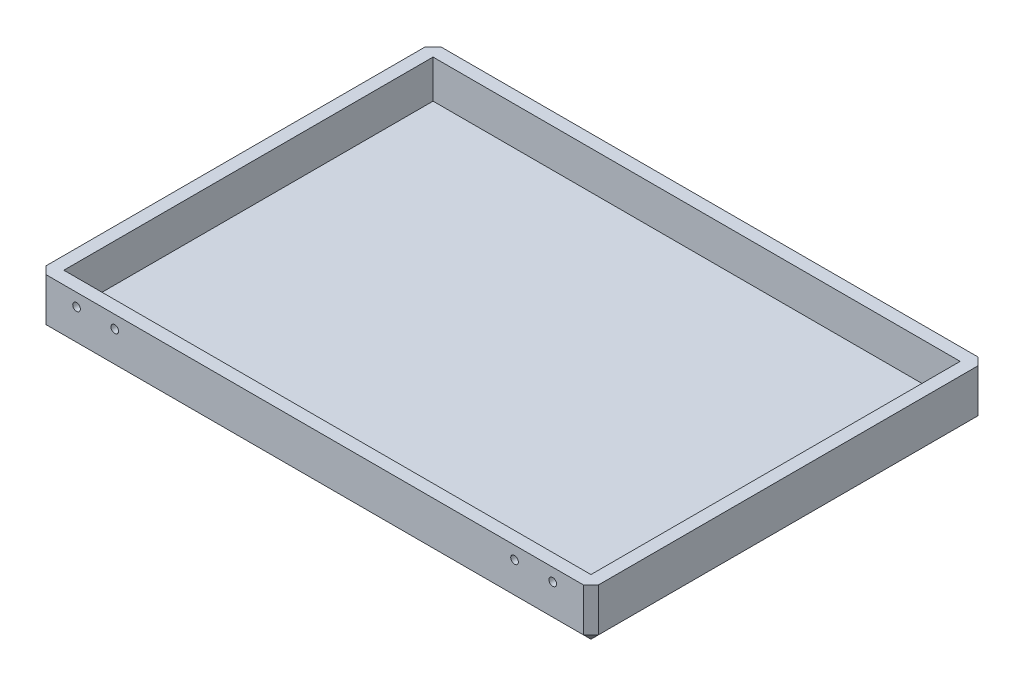
from build123d import *

# Parameters (mm, degrees)
SKIZZE2_W                       = 217
SKIZZE2_H                       = 155
AUFSATZ_LINEAR_AUSTRAGEN1_DEPTH = 20
WANDUNG1_T                      = -5
SCHNITT_LINEAR_AUSTRAGEN1_REACH = 192.256
SKIZZE7_R                       = 1.5
FASE1_SIZE                      = 3
SCHNITT_LINEAR_AUSTRAGEN2_DEPTH = 1


with BuildPart() as part:
    # Skizze2 → Aufsatz-Linear austragen1 (new body)
    with BuildSketch(Plane(origin=(0, 0, 0), x_dir=(1, 0, 0), z_dir=(0, 1, 0))):
        Rectangle(SKIZZE2_W, SKIZZE2_H)
    extrude(amount=AUFSATZ_LINEAR_AUSTRAGEN1_DEPTH)

    # Wandung1
    wandung1_openings = [part.faces().sort_by_distance(p)[0] for p in [
        (0, 20, 0),
    ]]
    offset(amount=WANDUNG1_T, openings=wandung1_openings, kind=Kind.INTERSECTION)

    # Skizze7 → Schnitt-Linear austragen1 (cut, up to next)
    with BuildSketch(Plane.XY.offset(77.5), mode=Mode.PRIVATE) as schnitt_linear_austragen1_sk1:
        with Locations((-93.5, 15)):
            Circle(SKIZZE7_R)
    schnitt_linear_austragen1_tool1 = extrude(schnitt_linear_austragen1_sk1.sketch, amount=-SCHNITT_LINEAR_AUSTRAGEN1_REACH, mode=Mode.PRIVATE) & part.part
    # Skizze7 → Schnitt-Linear austragen1 (cut, up to next)
    with BuildSketch(Plane.XY.offset(77.5), mode=Mode.PRIVATE) as schnitt_linear_austragen1_sk2:
        with Locations((-78.5, 15)):
            Circle(SKIZZE7_R)
    schnitt_linear_austragen1_tool2 = extrude(schnitt_linear_austragen1_sk2.sketch, amount=-SCHNITT_LINEAR_AUSTRAGEN1_REACH, mode=Mode.PRIVATE) & part.part
    # Skizze7 → Schnitt-Linear austragen1 (cut, up to next)
    with BuildSketch(Plane.XY.offset(77.5), mode=Mode.PRIVATE) as schnitt_linear_austragen1_sk3:
        with Locations((78.5, 15)):
            Circle(SKIZZE7_R)
    schnitt_linear_austragen1_tool3 = extrude(schnitt_linear_austragen1_sk3.sketch, amount=-SCHNITT_LINEAR_AUSTRAGEN1_REACH, mode=Mode.PRIVATE) & part.part
    # Skizze7 → Schnitt-Linear austragen1 (cut, up to next)
    with BuildSketch(Plane.XY.offset(77.5), mode=Mode.PRIVATE) as schnitt_linear_austragen1_sk4:
        with Locations((93.5, 15)):
            Circle(SKIZZE7_R)
    schnitt_linear_austragen1_tool4 = extrude(schnitt_linear_austragen1_sk4.sketch, amount=-SCHNITT_LINEAR_AUSTRAGEN1_REACH, mode=Mode.PRIVATE) & part.part
    add(schnitt_linear_austragen1_tool1.solids().sort_by_distance((-93.5, 15, 77.5))[0], mode=Mode.SUBTRACT)
    add(schnitt_linear_austragen1_tool2.solids().sort_by_distance((-78.5, 15, 77.5))[0], mode=Mode.SUBTRACT)
    add(schnitt_linear_austragen1_tool3.solids().sort_by_distance((78.5, 15, 77.5))[0], mode=Mode.SUBTRACT)
    add(schnitt_linear_austragen1_tool4.solids().sort_by_distance((93.5, 15, 77.5))[0], mode=Mode.SUBTRACT)

    # Fase1
    fase1_edges = [part.edges().sort_by_distance(p)[0] for p in [
        (0, 0, 77.5),
        (-108.5, 0, 0),
        (0, 0, -77.5),
        (108.5, 0, 0),
        (108.5, 10, 77.5),
        (-108.5, 10, 77.5),
        (-108.5, 10, -77.5),
        (108.5, 10, -77.5),
    ]]
    chamfer(fase1_edges, length=FASE1_SIZE)

    # Skizze8 → Schnitt-Linear austragen2 (cut)
    with BuildSketch(Plane.XZ):
        with BuildLine():
            Line((-96.881197846, -69.2), (-96.881197846, -62.8))
            ThreePointArc((-96.881197846, -62.8), (-96.969065812, -62.587867966), (-97.181197846, -62.5))
            Line((-97.181197846, -62.5), (-99.980384758, -62.5))
            ThreePointArc((-99.980384758, -62.5), (-100.240192379, -62.35), (-100.240192379, -62.05))
            Line((-100.240192379, -62.05), (-96.441005468, -55.469615242))
            ThreePointArc((-96.441005468, -55.469615242), (-96.103552133, -55.329837494), (-95.881197846, -55.619615242))
            Line((-95.881197846, -55.619615242), (-95.881197846, -61.2))
            ThreePointArc((-95.881197846, -61.2), (-95.793329881, -61.412132034), (-95.581197846, -61.5))
            Line((-95.581197846, -61.5), (-91.181197846, -61.5))
            ThreePointArc((-91.181197846, -61.5), (-90.969065812, -61.412132034), (-90.881197846, -61.2))
            Line((-90.881197846, -61.2), (-90.881197846, -54.8))
            ThreePointArc((-90.881197846, -54.8), (-90.793329881, -54.587867966), (-90.581197846, -54.5))
            Line((-90.581197846, -54.5), (-90.181197846, -54.5))
            ThreePointArc((-90.181197846, -54.5), (-89.969065812, -54.587867966), (-89.881197846, -54.8))
            Line((-89.881197846, -54.8), (-89.881197846, -61.2))
            ThreePointArc((-89.881197846, -61.2), (-89.793329881, -61.412132034), (-89.581197846, -61.5))
            Line((-89.581197846, -61.5), (-86.782010935, -61.5))
            ThreePointArc((-86.782010935, -61.5), (-86.522203314, -61.65), (-86.522203314, -61.95))
            Line((-86.522203314, -61.95), (-90.321390225, -68.530384758))
            ThreePointArc((-90.321390225, -68.530384758), (-90.65884356, -68.670162506), (-90.881197846, -68.380384758))
            Line((-90.881197846, -68.380384758), (-90.881197846, -62.8))
            ThreePointArc((-90.881197846, -62.8), (-90.969065812, -62.587867966), (-91.181197846, -62.5))
            Line((-91.181197846, -62.5), (-95.581197846, -62.5))
            ThreePointArc((-95.581197846, -62.5), (-95.793329881, -62.587867966), (-95.881197846, -62.8))
            Line((-95.881197846, -62.8), (-95.881197846, -69.2))
            ThreePointArc((-95.881197846, -69.2), (-95.969065812, -69.412132034), (-96.181197846, -69.5))
            Line((-96.181197846, -69.5), (-96.581197846, -69.5))
            ThreePointArc((-96.581197846, -69.5), (-96.793329881, -69.412132034), (-96.881197846, -69.2))
        make_face()
        with BuildLine():
            Line((-97.441005468, -59.20166605), (-98.508141571, -61.05))
            ThreePointArc((-98.508141571, -61.05), (-98.508141571, -61.35), (-98.24833395, -61.5))
            Line((-98.24833395, -61.5), (-97.181197846, -61.5))
            ThreePointArc((-97.181197846, -61.5), (-96.969065812, -61.412132034), (-96.881197846, -61.2))
            Line((-96.881197846, -61.2), (-96.881197846, -59.35166605))
            ThreePointArc((-96.881197846, -59.35166605), (-97.103552133, -59.061888302), (-97.441005468, -59.20166605))
        make_face(mode=Mode.SUBTRACT)
        with BuildLine():
            Line((-88.254254122, -62.95), (-89.321390225, -64.79833395))
            ThreePointArc((-89.321390225, -64.79833395), (-89.65884356, -64.938111698), (-89.881197846, -64.64833395))
            Line((-89.881197846, -64.64833395), (-89.881197846, -62.8))
            ThreePointArc((-89.881197846, -62.8), (-89.793329881, -62.587867966), (-89.581197846, -62.5))
            Line((-89.581197846, -62.5), (-88.514061743, -62.5))
            ThreePointArc((-88.514061743, -62.5), (-88.254254122, -62.65), (-88.254254122, -62.95))
        make_face(mode=Mode.SUBTRACT)
    extrude(amount=-SCHNITT_LINEAR_AUSTRAGEN2_DEPTH, mode=Mode.SUBTRACT)


solid = part.part
